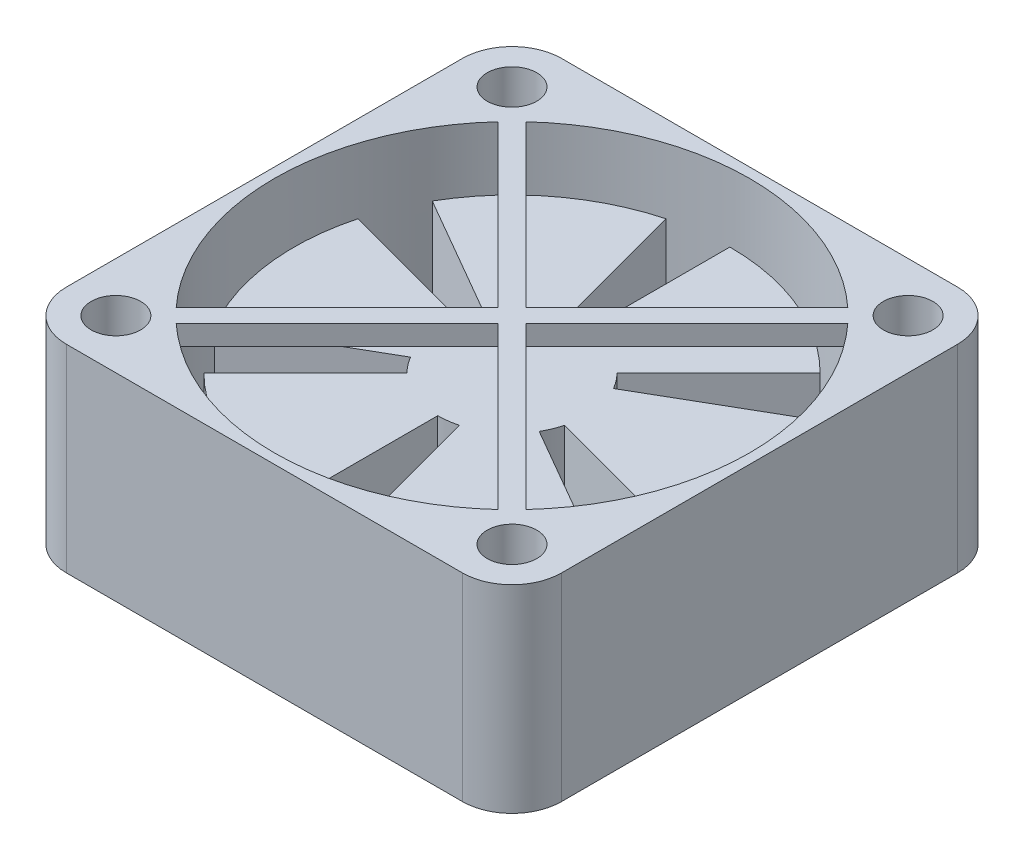
from build123d import *

# Parameters (mm, degrees)
SKETCH1_W           = 50
SKETCH1_H           = 50
SKETCH1_R           = 2.5
BOSS_EXTRUDE1_DEPTH = 20
SKETCH2_R           = 24
CUT_EXTRUDE1_DEPTH  = 20
BOSS_EXTRUDE2_START = 5
BOSS_EXTRUDE2_DEPTH = 10
BOSS_EXTRUDE3_DEPTH = 2
FILLET1_R           = 5


with BuildPart() as part:
    # Sketch1 → Boss-Extrude1 (new body)
    with BuildSketch(Plane(origin=(0, 0, 0), x_dir=(1, 0, 0), z_dir=(0, 1, 0))):
        Rectangle(SKETCH1_W, SKETCH1_H)
        with Locations(Location((-20, 20, 0), (0, 0, 270))):
            Circle(SKETCH1_R, mode=Mode.SUBTRACT)
        with Locations(Location((20, 20, 0), (0, 0, 270))):
            Circle(SKETCH1_R, mode=Mode.SUBTRACT)
        with Locations(Location((20, -20, 0), (0, 0, 270))):
            Circle(SKETCH1_R, mode=Mode.SUBTRACT)
        with Locations(Location((-20, -20, 0), (0, 0, 270))):
            Circle(SKETCH1_R, mode=Mode.SUBTRACT)
    extrude(amount=BOSS_EXTRUDE1_DEPTH)

    # Sketch2 → Cut-Extrude1 (cut)
    with BuildSketch(Plane(origin=(0, 20, 0), x_dir=(1, 0, 0), z_dir=(0, 1, 0))):
        with Locations(Location((0, 0, 0), (0, 0, 270))):
            Circle(SKETCH2_R)
    extrude(amount=-CUT_EXTRUDE1_DEPTH, mode=Mode.SUBTRACT)

    # Sketch4 → Boss-Extrude3 (add)
    with BuildSketch(Plane(origin=(0, 20, 0), x_dir=(1, 0, 0), z_dir=(0, 1, 0))):
        with BuildLine():
            Line((16.248718177, 17.662931739), (0, 1.414213562))
            Line((0, 1.414213562), (-16.248718177, 17.662931739))
            ThreePointArc((-16.248718177, 17.662931739), (-16.970562748, 16.970562748), (-17.662931739, 16.248718177))
            Line((-17.662931739, 16.248718177), (-1.414213562, 0))
            Line((-1.414213562, 0), (-17.662931739, -16.248718177))
            ThreePointArc((-17.662931739, -16.248718177), (-16.970562748, -16.970562748), (-16.248718177, -17.662931739))
            Line((-16.248718177, -17.662931739), (0, -1.414213562))
            Line((0, -1.414213562), (16.248718177, -17.662931739))
            ThreePointArc((16.248718177, -17.662931739), (16.970562748, -16.970562748), (17.662931739, -16.248718177))
            Line((17.662931739, -16.248718177), (1.414213562, 0))
            Line((1.414213562, 0), (17.662931739, 16.248718177))
            ThreePointArc((17.662931739, 16.248718177), (16.970562748, 16.970562748), (16.248718177, 17.662931739))
        make_face()
    extrude(amount=-BOSS_EXTRUDE3_DEPTH)

    # Fillet1
    fillet1_edges = [part.edges().sort_by_distance(p)[0] for p in [
        (25, 10, 25),
        (-25, 10, 25),
        (-25, 10, -25),
        (25, 10, -25),
    ]]
    fillet(fillet1_edges, radius=FILLET1_R)


with BuildPart() as body_2:
    # Sketch3 → Boss-Extrude2 (new body)
    with BuildSketch(Plane(origin=(0, 0, 0), x_dir=(1, 0, 0), z_dir=(0, 1, 0)).offset(BOSS_EXTRUDE2_START)):
        with BuildLine():
            Line((0, 7.5), (0, 22))
            ThreePointArc((0, 22), (8.419035512, 20.325349715), (15.556349186, 15.556349186))
            Line((15.556349186, 15.556349186), (5.303300859, 5.303300859))
            ThreePointArc((5.303300859, 5.303300859), (5.950150052, 4.565710718), (6.495190528, 3.75))
            Line((6.495190528, 3.75), (19.052558883, 11))
            ThreePointArc((19.052558883, 11), (21.81178695, 2.871576229), (21.250368178, -5.694018992))
            Line((21.250368178, -5.694018992), (7.244443697, -1.941142838))
            ThreePointArc((7.244443697, -1.941142838), (6.929096494, -2.870125743), (6.495190528, -3.75))
            Line((6.495190528, -3.75), (19.052558883, -11))
            ThreePointArc((19.052558883, -11), (13.392751438, -17.453773486), (5.694018992, -21.250368178))
            Line((5.694018992, -21.250368178), (1.941142838, -7.244443697))
            ThreePointArc((1.941142838, -7.244443697), (0.978946442, -7.43583646), (0, -7.5))
            Line((0, -7.5), (0, -22))
            ThreePointArc((0, -22), (-8.419035512, -20.325349715), (-15.556349186, -15.556349186))
            Line((-15.556349186, -15.556349186), (-5.303300859, -5.303300859))
            ThreePointArc((-5.303300859, -5.303300859), (-5.950150052, -4.565710718), (-6.495190528, -3.75))
            Line((-6.495190528, -3.75), (-19.052558883, -11))
            ThreePointArc((-19.052558883, -11), (-21.81178695, -2.871576229), (-21.250368178, 5.694018992))
            Line((-21.250368178, 5.694018992), (-7.244443697, 1.941142838))
            ThreePointArc((-7.244443697, 1.941142838), (-6.929096494, 2.870125743), (-6.495190528, 3.75))
            Line((-6.495190528, 3.75), (-19.052558883, 11))
            ThreePointArc((-19.052558883, 11), (-13.392751438, 17.453773486), (-5.694018992, 21.250368178))
            Line((-5.694018992, 21.250368178), (-1.941142838, 7.244443697))
            ThreePointArc((-1.941142838, 7.244443697), (-0.978946442, 7.43583646), (0, 7.5))
        make_face()
    extrude(amount=BOSS_EXTRUDE2_DEPTH)


solid = Compound([part.part, body_2.part])
